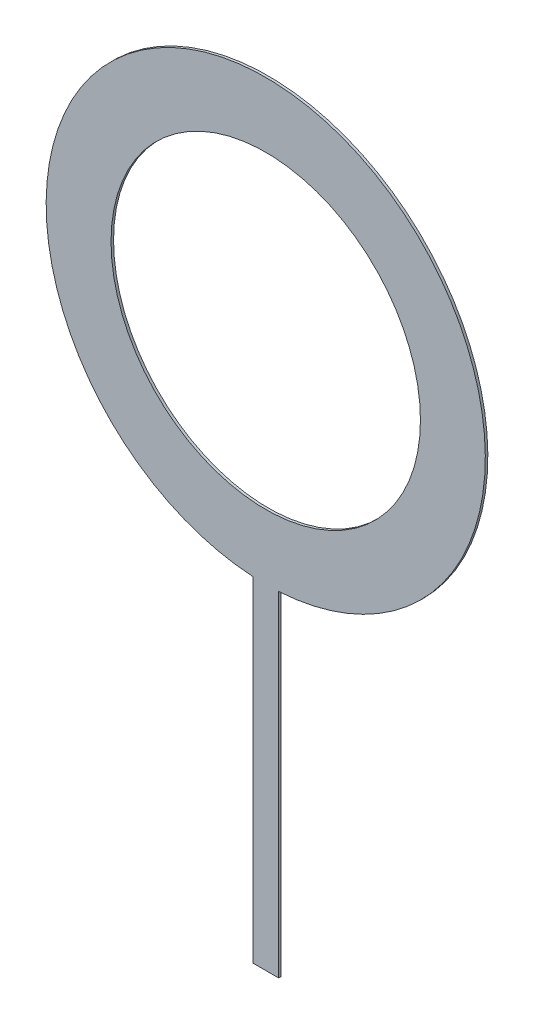
from build123d import *

# Parameters (mm, degrees)
BOSS_EXTRUDE1_DEPTH = 0.127


with BuildPart() as part:
    # Sketch1 → Boss-Extrude1 (new body)
    # profile 1 of 5: a face of its own
    with BuildSketch(Plane.XY):
        with BuildLine():
            Line((-0.65, -7.75), (0, -7.75))
            Line((0, -7.75), (0.65, -7.75))
            Line((0.65, -7.75), (0.65, -10.980778661))
            ThreePointArc((0.65, -10.980778661), (8.004686128, -7.544865804), (11, 0))
            ThreePointArc((11, 0), (-7.544865804, 8.004686128), (-0.65, -10.980778661))
            Line((-0.65, -10.980778661), (-0.65, -7.75))
        make_face()
        with BuildLine():
            ThreePointArc((7.75, 0), (5.480077554, -5.480077554), (0, -7.75))
            ThreePointArc((0, -7.75), (-5.480077554, 5.480077554), (7.75, 0))
        make_face(mode=Mode.SUBTRACT)
    # profile 2 of 5: a face of its own
    with BuildSketch(Plane.XY):
        with BuildLine():
            Line((0.65, -7.75), (0, -7.75))
            Line((0, -7.75), (0, -11))
            ThreePointArc((0, -11), (0.325142069, -10.995193615), (0.65, -10.980778661))
            Line((0.65, -10.980778661), (0.65, -7.75))
        make_face()
    # profile 3 of 5: a face of its own
    with BuildSketch(Plane.XY):
        with BuildLine():
            Line((0, -11), (0, -7.75))
            Line((0, -7.75), (-0.65, -7.75))
            Line((-0.65, -7.75), (-0.65, -10.980778661))
            ThreePointArc((-0.65, -10.980778661), (-0.325142069, -10.995193615), (0, -11))
        make_face()
    # profile 4 of 5: a face of its own
    with BuildSketch(Plane.XY):
        with BuildLine():
            Line((0, -27.75), (0, -11))
            ThreePointArc((0, -11), (-0.325142069, -10.995193615), (-0.65, -10.980778661))
            Line((-0.65, -10.980778661), (-0.65, -27.75))
            Line((-0.65, -27.75), (0, -27.75))
        make_face()
    # profile 5 of 5: a face of its own
    with BuildSketch(Plane.XY):
        with BuildLine():
            ThreePointArc((0.65, -10.980778661), (0.325142069, -10.995193615), (0, -11))
            Line((0, -11), (0, -27.75))
            Line((0, -27.75), (0.65, -27.75))
            Line((0.65, -27.75), (0.65, -10.980778661))
        make_face()
    extrude(amount=BOSS_EXTRUDE1_DEPTH)


solid = part.part
